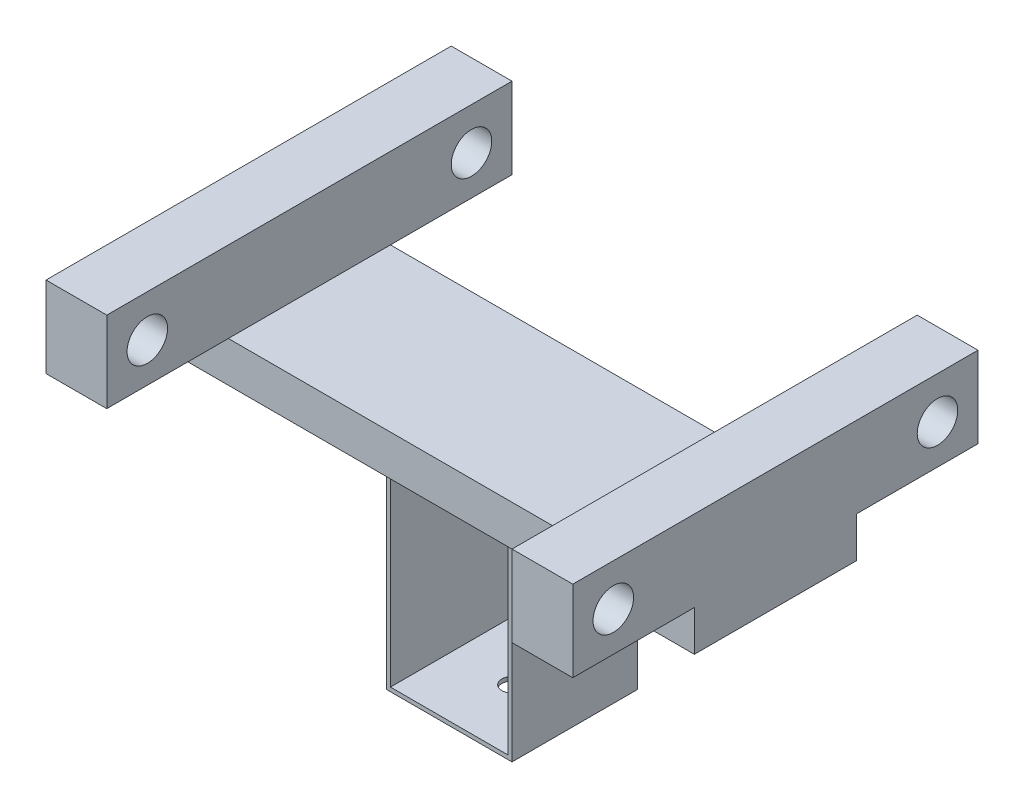
from build123d import *

# Parameters (mm, degrees)
SKETCH1_W           = 130
SKETCH1_H           = 40
BOSS_EXTRUDE1_DEPTH = 10
SKETCH3_W           = 31
SKETCH3_H           = 31
BOSS_EXTRUDE3_DEPTH = 50
SKETCH4_W           = 29
SKETCH4_H           = 48
CUT_EXTRUDE1_DEPTH  = 90.360226052
CUT_EXTRUDE2_REACH  = 92.692
SKETCH5_R           = 2.5
SKETCH2_W           = 15
SKETCH2_H           = 100
BOSS_EXTRUDE4_DEPTH = 20
SKETCH6_R           = 5
CUT_EXTRUDE3_DEPTH  = 20


with BuildPart() as part:
    # Sketch1 → Boss-Extrude1 (new body)
    with BuildSketch(Plane(origin=(0, 0, 0), x_dir=(1, 0, 0), z_dir=(0, 1, 0))):
        Rectangle(SKETCH1_W, SKETCH1_H)
    extrude(amount=BOSS_EXTRUDE1_DEPTH)

    # Sketch3 → Boss-Extrude3 (add)
    with BuildSketch(Plane.XZ):
        Rectangle(SKETCH3_W, SKETCH3_H)
    extrude(amount=BOSS_EXTRUDE3_DEPTH)

    # Sketch4 → Cut-Extrude1 (cut, through all)
    with BuildSketch(Plane(origin=(0, 0, -15.5), x_dir=(-1, 0, 0), z_dir=(0, 0, -1))):
        with Locations((0, -25)):
            Rectangle(SKETCH4_W, SKETCH4_H)
    extrude(amount=-CUT_EXTRUDE1_DEPTH, mode=Mode.SUBTRACT)

    # Sketch5 → Cut-Extrude2 (cut, up to next)
    with BuildSketch(Plane.XZ.offset(50), mode=Mode.PRIVATE) as cut_extrude2_sk1:
        Circle(SKETCH5_R)
    cut_extrude2_tool1 = extrude(cut_extrude2_sk1.sketch, amount=-CUT_EXTRUDE2_REACH, mode=Mode.PRIVATE) & part.part
    add(cut_extrude2_tool1.solids().sort_by_distance((0, -50, 0))[0], mode=Mode.SUBTRACT)

    # Sketch2 → Boss-Extrude4 (add)
    with BuildSketch(Plane(origin=(0, 10, 0), x_dir=(1, 0, 0), z_dir=(0, 1, 0))):
        with Locations((-57.5, 0)):
            Rectangle(SKETCH2_W, SKETCH2_H)
    boss_extrude4 = extrude(amount=BOSS_EXTRUDE4_DEPTH)

    # Sketch6 → Cut-Extrude3 (cut)
    with BuildSketch(Plane(origin=(-50, 0, 0), x_dir=(0, 0, -1), z_dir=(1, 0, 0))):
        with Locations((-40, 19.678033473)):
            Circle(SKETCH6_R)
        with Locations((40, 19.678033473)):
            Circle(SKETCH6_R)
    cut_extrude3 = extrude(amount=-CUT_EXTRUDE3_DEPTH, mode=Mode.SUBTRACT)

    # Mirror1: Boss-Extrude4, Cut-Extrude3 across plane
    add(boss_extrude4.mirror(Plane(origin=(0, 0, 0), x_dir=(0, 0, 1), z_dir=(1, 0, 0))))
    add(cut_extrude3.mirror(Plane(origin=(0, 0, 0), x_dir=(0, 0, 1), z_dir=(1, 0, 0))), mode=Mode.SUBTRACT)


solid = part.part
